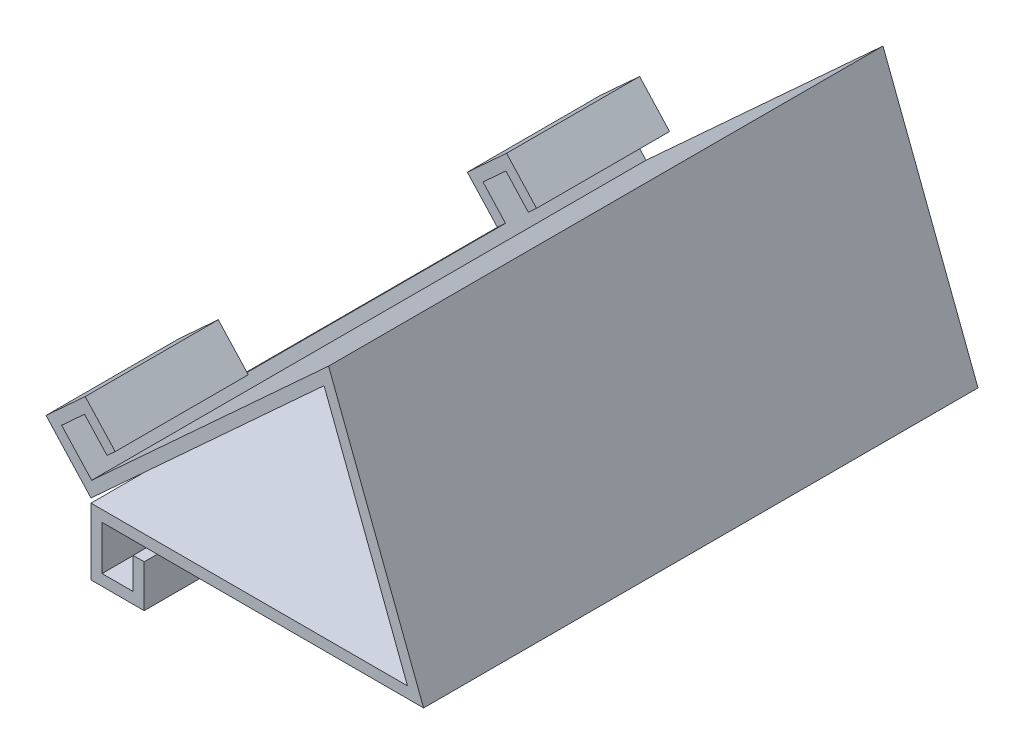
from build123d import *

# Parameters (mm, degrees)
BOSS_EXTRUDE1_DEPTH = 31.75
SKETCH2_W           = 16.51
SKETCH2_H           = 2.54
CUT_EXTRUDE1_DEPTH  = 31.75
SKETCH3_W           = 16.51
SKETCH3_H           = 2.54
CUT_EXTRUDE2_DEPTH  = 31.75


with BuildPart() as part:
    # Sketch1 → Boss-Extrude1 (new body)
    with BuildSketch(Plane.XY):
        Polygon((2.413, -2.54), (2.413, -0.750440267), (3.048, -0.750440267), (3.048, -3.175), (0, -3.175), (0, 0.635), (18.127436567, 0.635), (13.348744151, 13.135564727), (0, 0.889), (-2.575678152, 3.696486787), (-0.329688722, 5.757029308), (1.387430046, 3.88537145), (0.919515581, 3.456091758), (-0.368323494, 4.859835152), (-1.678483995, 3.657852015), (0.038634773, 1.786194156), (13.608154244, 14.235305222), (19.05, 0), (0.635, 0), (0.635, -2.54), align=None)
    extrude(amount=BOSS_EXTRUDE1_DEPTH)

    # Sketch2 → Cut-Extrude1 (cut)
    with BuildSketch(Plane(origin=(0.442854564, 0.406288938, 0), x_dir=(0, 0, 1), z_dir=(-0.7368731724730907, -0.676031010893319, 0))):
        with Locations((15.875, 3.19508025)):
            Rectangle(SKETCH2_W, SKETCH2_H)
    extrude(amount=-CUT_EXTRUDE1_DEPTH, mode=Mode.SUBTRACT)

    # Sketch3 → Cut-Extrude2 (cut)
    with BuildSketch(Plane.ZY):
        with Locations((15.875, -1.905)):
            Rectangle(SKETCH3_W, SKETCH3_H)
    extrude(amount=-CUT_EXTRUDE2_DEPTH, mode=Mode.SUBTRACT)


solid = part.part
